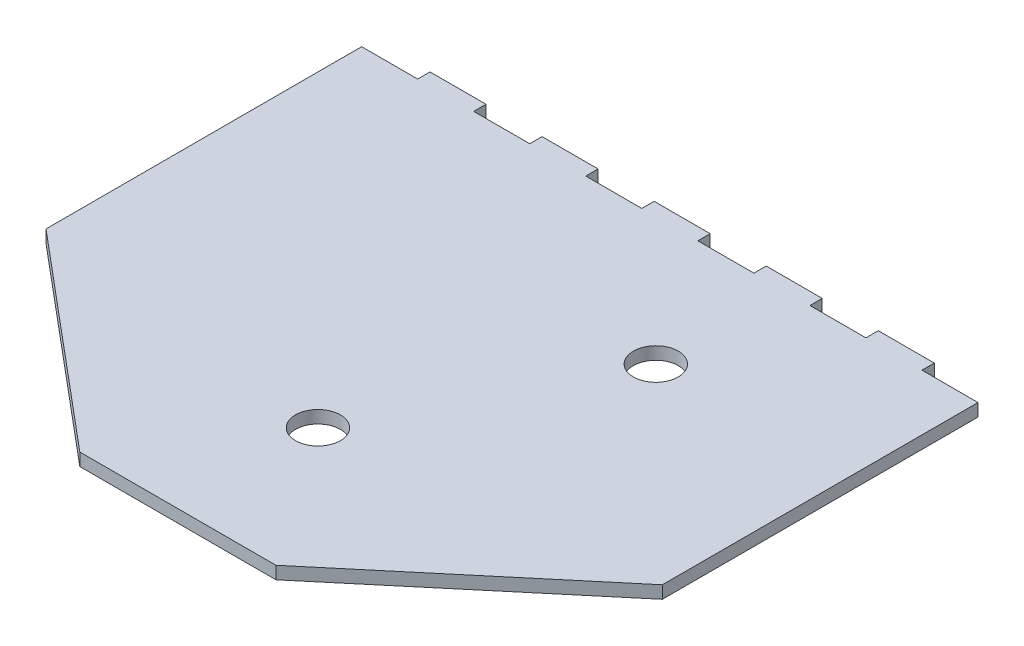
from build123d import *

# Parameters (mm, degrees)
SKETCH2_W           = 220
SKETCH2_H           = 180
BOSS_EXTRUDE1_DEPTH = 4.5
CHAMFER1_SIZE       = 75
CHAMFER1_SIZE2      = 62.932472338
SKETCH3_R           = 8
CUT_EXTRUDE1_DEPTH  = 143.197925442
SKETCH4_W           = 20
SKETCH4_H           = 4.4
CUT_EXTRUDE2_DEPTH  = 143.197925442


with BuildPart() as part:
    # Sketch2 → Boss-Extrude1 (new body)
    with BuildSketch(Plane(origin=(0, 0, 0), x_dir=(1, 0, 0), z_dir=(0, 1, 0))):
        Rectangle(SKETCH2_W, SKETCH2_H)
    extrude(amount=BOSS_EXTRUDE1_DEPTH)

    # Chamfer1
    chamfer1_edges = [part.edges().sort_by_distance(p)[0] for p in [
        (110, 2.25, 90),
        (-110, 2.25, 90),
    ]]
    chamfer1_side = [part.faces().sort_by_distance(p)[0] for p in [
        (0, 2.25, 90),
    ]]
    chamfer(chamfer1_edges, length=CHAMFER1_SIZE, length2=CHAMFER1_SIZE2, reference=chamfer1_side[0])

    # Sketch3 → Cut-Extrude1 (cut, through all)
    with BuildSketch(Plane(origin=(0, 4.5, 0), x_dir=(1, 0, 0), z_dir=(0, 1, 0))):
        with Locations(Location((0, -40, 0), (0, 0, 270))):
            Circle(SKETCH3_R)
        with Locations(Location((40.6, 40, 0), (0, 0, 270))):
            Circle(SKETCH3_R)
    extrude(amount=-CUT_EXTRUDE1_DEPTH, mode=Mode.SUBTRACT)

    # Sketch4 → Cut-Extrude2 (cut, through all)
    with BuildSketch(Plane.XZ):
        with Locations((100, -87.8)):
            Rectangle(SKETCH4_W, SKETCH4_H)
        with Locations((60, -87.8)):
            Rectangle(SKETCH4_W, SKETCH4_H)
        with Locations((20, -87.8)):
            Rectangle(SKETCH4_W, SKETCH4_H)
        with Locations((-20, -87.8)):
            Rectangle(SKETCH4_W, SKETCH4_H)
        with Locations((-60, -87.8)):
            Rectangle(SKETCH4_W, SKETCH4_H)
        with Locations((-100, -87.8)):
            Rectangle(SKETCH4_W, SKETCH4_H)
    extrude(amount=-CUT_EXTRUDE2_DEPTH, mode=Mode.SUBTRACT)


solid = part.part
